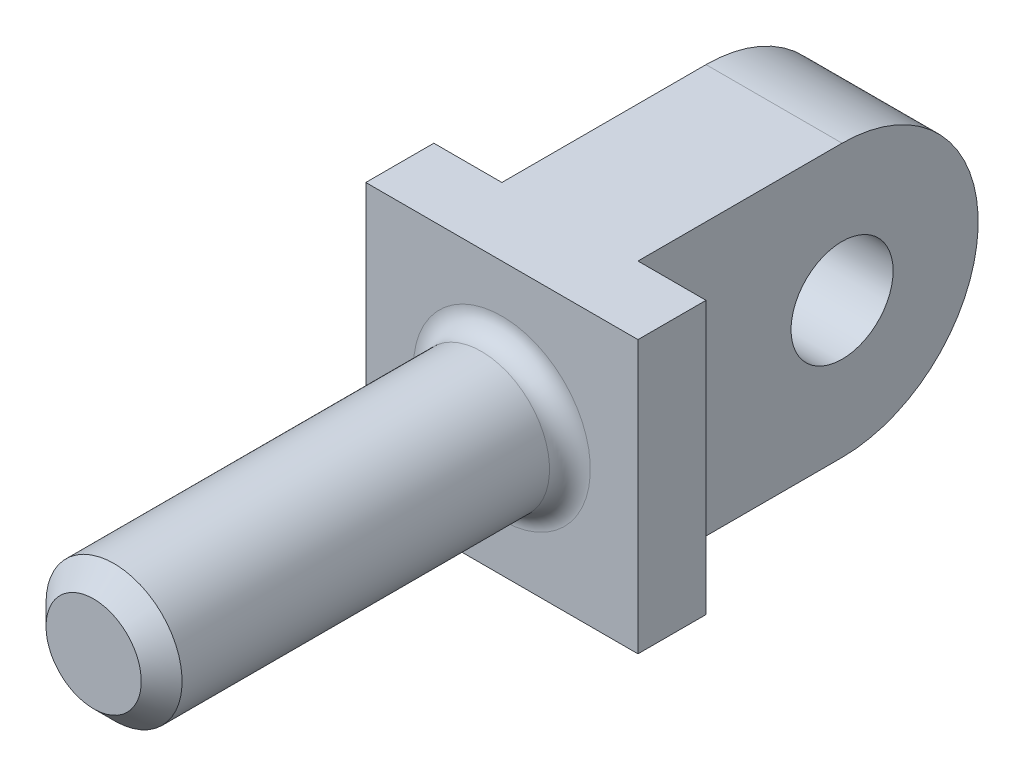
from build123d import *

# Parameters (mm, degrees)
SKETCH1_W         = 50.8
SKETCH1_H         = 50.8
SQUARE_BASE_DEPTH = 12.7
SKETCH2_R         = 12.7
LONG_PIN_DEPTH    = 76.2
SKETCH3_R         = 9.525
EYELET_DEPTH      = 12.7
FILLET1_R         = 3.81
CHAMFER1_SIZE     = 3.81


with BuildPart() as part:
    # Sketch1 → Square Base (new body)
    with BuildSketch(Plane.XY):
        Rectangle(SKETCH1_W, SKETCH1_H)
    extrude(amount=-SQUARE_BASE_DEPTH)

    # Sketch2 → Long Pin (add)
    with BuildSketch(Plane.XY):
        with Locations(Location((0, 0, 0), (0, 0, 180))):
            Circle(SKETCH2_R)
    extrude(amount=LONG_PIN_DEPTH)

    # Sketch3 → Eyelet (add, symmetric)
    with BuildSketch(Plane(origin=(0, 0, 0), x_dir=(0, 0, -1), z_dir=(1, 0, 0))):
        with BuildLine():
            Line((12.7, 25.4), (50.8, 25.4))
            ThreePointArc((50.8, 25.4), (76.2, 0), (50.8, -25.4))
            Line((50.8, -25.4), (12.7, -25.4))
            Line((12.7, -25.4), (12.7, 25.4))
        make_face()
        with Locations((50.8, 0)):
            Circle(SKETCH3_R, mode=Mode.SUBTRACT)
    extrude(amount=EYELET_DEPTH, both=True)

    # Fillet1
    fillet1_edges = [part.edges().sort_by_distance(p)[0] for p in [
        (12.7, 0, 0),
    ]]
    fillet(fillet1_edges, radius=FILLET1_R)

    # Chamfer1
    chamfer1_edges = [part.edges().sort_by_distance(p)[0] for p in [
        (12.7, 0, 76.2),
    ]]
    chamfer(chamfer1_edges, length=CHAMFER1_SIZE)


solid = part.part
